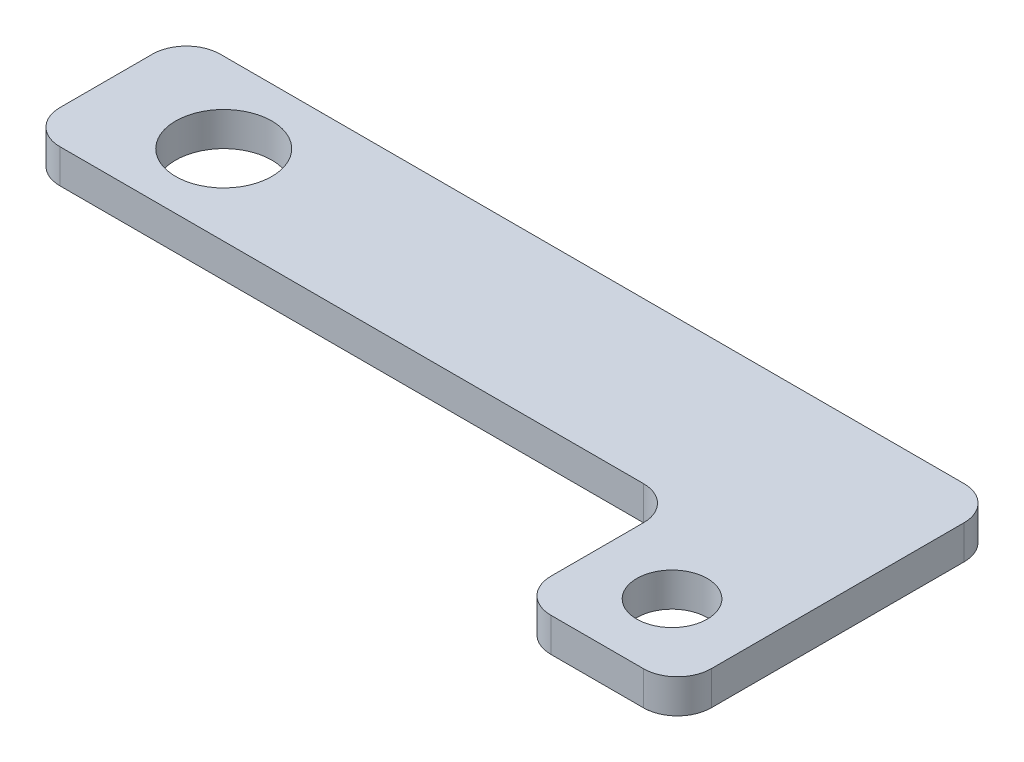
from build123d import *

# Parameters (mm, degrees)
BOSS_EXTRUDE1_DEPTH  = 3.175
M8_CLEARANCE_HOLE1_D = 9
M6_CLEARANCE_HOLE1_D = 6.6
FILLET1_R            = 3.175


with BuildPart() as part:
    # Sketch1 → Boss-Extrude1 (new body)
    with BuildSketch(Plane(origin=(0, 0, 0), x_dir=(1, 0, 0), z_dir=(0, 1, 0))):
        Polygon((6.05, -36.0812086), (56, -36.0812086), (56, -44.0812086), (56, -51.0812086), (71, -51.0812086), (71, -44.0812086), (71, -21.0812086), (6.05, -21.0812086), (-4.95, -21.0812086), (-4.95, -36.0812086), align=None)
    extrude(amount=-BOSS_EXTRUDE1_DEPTH)

    # M8 Clearance Hole1 (through all)
    with Locations(Plane(origin=(0, -3.175, 0), x_dir=(-1, 0, 0), z_dir=(0, -1, 0))):
        with Locations((-6.05, -28.5812086)):
            Hole(M8_CLEARANCE_HOLE1_D / 2)

    # M6 Clearance Hole1 (through all)
    with Locations(Plane(origin=(0, -3.175, 0), x_dir=(-1, 0, 0), z_dir=(0, -1, 0))):
        with Locations((-63.5, -44.0812086)):
            Hole(M6_CLEARANCE_HOLE1_D / 2)

    # Fillet1
    fillet1_edges = [part.edges().sort_by_distance(p)[0] for p in [
        (71, -1.5875, 51.0812086),
        (56, -1.5875, 51.0812086),
        (56, -1.5875, 36.0812086),
        (-4.95, -1.5875, 36.0812086),
        (-4.95, -1.5875, 21.0812086),
        (71, -1.5875, 21.0812086),
    ]]
    fillet(fillet1_edges, radius=FILLET1_R)


solid = part.part
